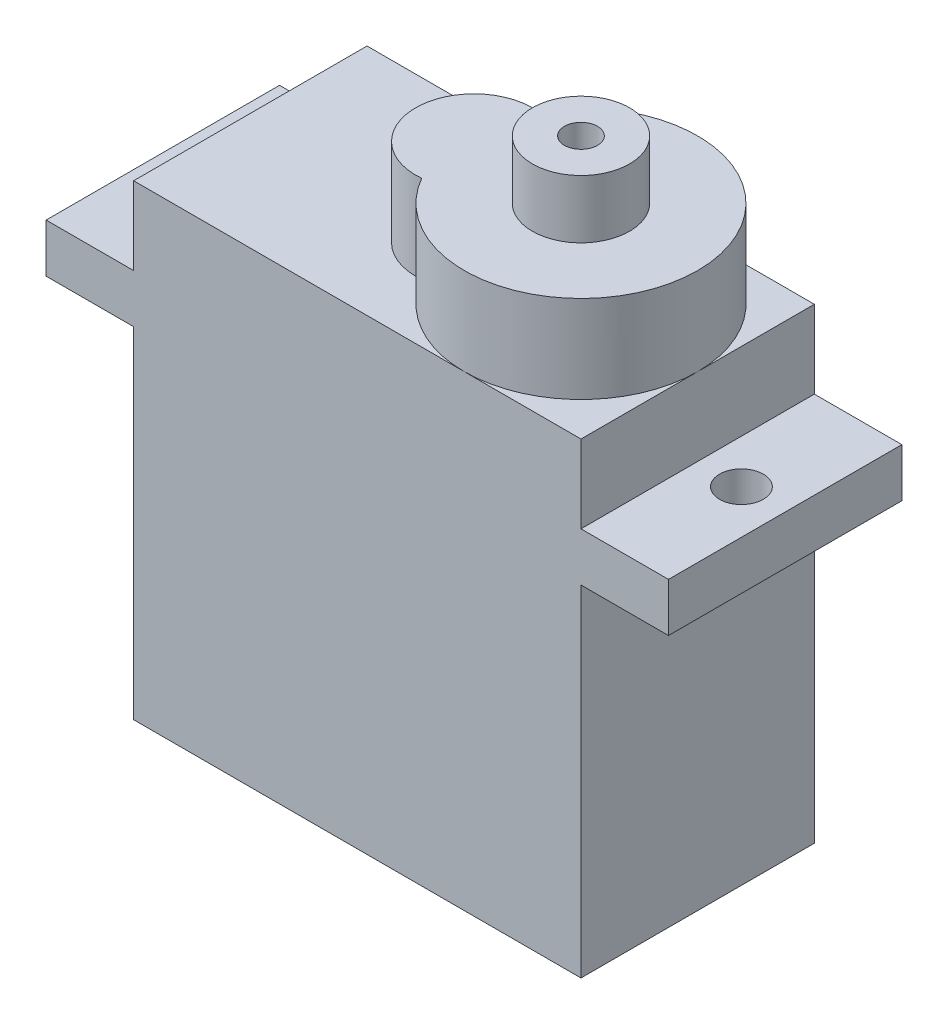
from build123d import *

# Parameters (mm, degrees)
SKETCH1_W           = 23
SKETCH1_H           = 12
BOSS_EXTRUDE1_DEPTH = 24
BOSS_EXTRUDE2_DEPTH = 4.5
SKETCH3_R           = 2.5
BOSS_EXTRUDE3_DEPTH = 3
SKETCH4_R           = 0.85
CUT_EXTRUDE1_DEPTH  = 5
BOSS_EXTRUDE6_START = -4
SKETCH5_W           = 4.5
SKETCH5_H           = 12
SKETCH5_R           = 1.125
BOSS_EXTRUDE6_DEPTH = 2.5


with BuildPart() as part:
    # Sketch1 → Boss-Extrude1 (new body)
    with BuildSketch(Plane(origin=(0, 0, 0), x_dir=(1, 0, 0), z_dir=(0, 1, 0))):
        Rectangle(SKETCH1_W, SKETCH1_H)
    extrude(amount=BOSS_EXTRUDE1_DEPTH)

    # Sketch2 → Boss-Extrude2 (add)
    with BuildSketch(Plane(origin=(0, 24, 0), x_dir=(1, 0, 0), z_dir=(0, 1, 0))):
        with BuildLine():
            ThreePointArc((0.295454545, 2.985415651), (-3, 0), (0.295454545, -2.985415651))
            ThreePointArc((0.295454545, -2.985415651), (11.5, 0), (0.295454545, 2.985415651))
        make_face()
    extrude(amount=BOSS_EXTRUDE2_DEPTH)

    # Sketch3 → Boss-Extrude3 (add)
    with BuildSketch(Plane(origin=(0, 28.5, 0), x_dir=(1, 0, 0), z_dir=(0, 1, 0))):
        with Locations(Location((5.5, 0, 0), (0, 0, 270))):
            Circle(SKETCH3_R)
    extrude(amount=BOSS_EXTRUDE3_DEPTH)

    # Sketch4 → Cut-Extrude1 (cut)
    with BuildSketch(Plane(origin=(0, 31.5, 0), x_dir=(1, 0, 0), z_dir=(0, 1, 0))):
        with Locations(Location((5.5, 0, 0), (0, 0, 270))):
            Circle(SKETCH4_R)
    extrude(amount=-CUT_EXTRUDE1_DEPTH, mode=Mode.SUBTRACT)

    # Sketch5 → Boss-Extrude6 (add)
    # profile 1 of 2: a face of its own
    with BuildSketch(Plane(origin=(0, 24, 0), x_dir=(1, 0, 0), z_dir=(0, 1, 0)).offset(BOSS_EXTRUDE6_START)):
        with Locations((-13.75, 0)):
            Rectangle(SKETCH5_W, SKETCH5_H)
        with Locations(Location((-13.75, 0, 0), (0, 0, 270))):
            Circle(SKETCH5_R, mode=Mode.SUBTRACT)
    # profile 2 of 2: a face of its own
    with BuildSketch(Plane(origin=(0, 24, 0), x_dir=(1, 0, 0), z_dir=(0, 1, 0)).offset(BOSS_EXTRUDE6_START)):
        with Locations((13.75, 0)):
            Rectangle(SKETCH5_W, SKETCH5_H)
        with Locations(Location((13.75, 0, 0), (0, 0, 90))):
            Circle(SKETCH5_R, mode=Mode.SUBTRACT)
    extrude(amount=-BOSS_EXTRUDE6_DEPTH)


solid = part.part
